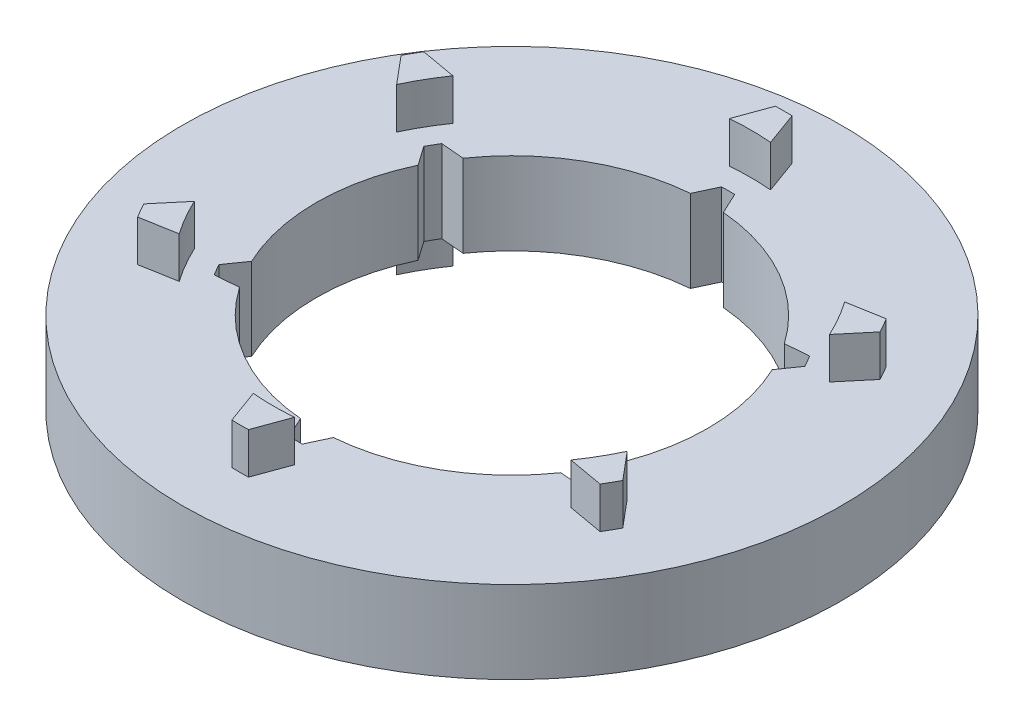
from build123d import *

# Parameters (mm, degrees)
SKETCH1_R           = 40
BOSS_EXTRUDE1_DEPTH = 10
BOSS_EXTRUDE6_DEPTH = 5
BOSS_EXTRUDE7_START = -15
BOSS_EXTRUDE7_DEPTH = 5


with BuildPart() as part:
    # Sketch1 → Boss-Extrude1 (new body)
    with BuildSketch(Plane(origin=(0, 0, 0), x_dir=(1, 0, 0), z_dir=(0, 1, 0))):
        with Locations(Location((0, 0, 0), (0, 0, 270))):
            Circle(SKETCH1_R)
        with BuildLine():
            Line((-2, 23.665639649), (-0.800587161, 26.237788783))
            ThreePointArc((-0.800587161, 26.237788783), (0, 26.25), (0.800587161, 26.237788783))
            Line((0.800587161, 26.237788783), (2, 23.665639649))
            ThreePointArc((2, 23.665639649), (11.875, 20.56810334), (19.495045133, 13.564870632))
            Line((19.495045133, 13.564870632), (22.322298044, 13.812223211))
            ThreePointArc((22.322298044, 13.812223211), (22.733166849, 13.125), (23.122885205, 12.425565572))
            Line((23.122885205, 12.425565572), (21.495045133, 10.100769017))
            ThreePointArc((21.495045133, 10.100769017), (23.75, 0), (21.495045133, -10.100769017))
            Line((21.495045133, -10.100769017), (23.122885205, -12.425565572))
            ThreePointArc((23.122885205, -12.425565572), (22.733166849, -13.125), (22.322298044, -13.812223211))
            Line((22.322298044, -13.812223211), (19.495045133, -13.564870632))
            ThreePointArc((19.495045133, -13.564870632), (11.875, -20.56810334), (2, -23.665639649))
            Line((2, -23.665639649), (0.800587161, -26.237788783))
            ThreePointArc((0.800587161, -26.237788783), (0, -26.25), (-0.800587161, -26.237788783))
            Line((-0.800587161, -26.237788783), (-2, -23.665639649))
            ThreePointArc((-2, -23.665639649), (-11.875, -20.56810334), (-19.495045133, -13.564870632))
            Line((-19.495045133, -13.564870632), (-22.322298044, -13.812223211))
            ThreePointArc((-22.322298044, -13.812223211), (-22.733166849, -13.125), (-23.122885205, -12.425565572))
            Line((-23.122885205, -12.425565572), (-21.495045133, -10.100769017))
            ThreePointArc((-21.495045133, -10.100769017), (-23.75, 0), (-21.495045133, 10.100769017))
            Line((-21.495045133, 10.100769017), (-23.122885205, 12.425565572))
            ThreePointArc((-23.122885205, 12.425565572), (-22.733166849, 13.125), (-22.322298044, 13.812223211))
            Line((-22.322298044, 13.812223211), (-19.495045133, 13.564870632))
            ThreePointArc((-19.495045133, 13.564870632), (-11.875, 20.56810334), (-2, 23.665639649))
        make_face(mode=Mode.SUBTRACT)
    extrude(amount=BOSS_EXTRUDE1_DEPTH)

    # 4,5,6 → Boss-Extrude6 (add)
    with BuildSketch(Plane(origin=(0, 10, 0), x_dir=(1, 0, 0), z_dir=(0, 1, 0))):
        with BuildLine():
            Line((2.5, 28.892040426), (1.010456949, 32.984526323))
            ThreePointArc((1.010456949, 32.984526323), (0, 33), (-1.010456949, 32.984526323))
            Line((-1.010456949, 32.984526323), (-2.5, 28.892040426))
            ThreePointArc((-2.5, 28.892040426), (0, 29), (2.5, 28.892040426))
        make_face()
        with BuildLine():
            Line((23.771240976, 16.611083723), (28.060209253, 17.367344549))
            ThreePointArc((28.060209253, 17.367344549), (28.578838325, 16.5), (29.070666202, 15.617181774))
            Line((29.070666202, 15.617181774), (26.271240976, 12.280956704))
            ThreePointArc((26.271240976, 12.280956704), (25.11473671, 14.5), (23.771240976, 16.611083723))
        make_face()
        with BuildLine():
            Line((26.271240976, -12.280956704), (29.070666202, -15.617181774))
            ThreePointArc((29.070666202, -15.617181774), (28.578838325, -16.5), (28.060209253, -17.367344549))
            Line((28.060209253, -17.367344549), (23.771240976, -16.611083723))
            ThreePointArc((23.771240976, -16.611083723), (25.11473671, -14.5), (26.271240976, -12.280956704))
        make_face()
        with BuildLine():
            Line((2.5, -28.892040426), (1.010456949, -32.984526323))
            ThreePointArc((1.010456949, -32.984526323), (0, -33), (-1.010456949, -32.984526323))
            Line((-1.010456949, -32.984526323), (-2.5, -28.892040426))
            ThreePointArc((-2.5, -28.892040426), (0, -29), (2.5, -28.892040426))
        make_face()
        with BuildLine():
            Line((-23.771240976, -16.611083723), (-28.060209253, -17.367344549))
            ThreePointArc((-28.060209253, -17.367344549), (-28.578838325, -16.5), (-29.070666202, -15.617181774))
            Line((-29.070666202, -15.617181774), (-26.271240976, -12.280956704))
            ThreePointArc((-26.271240976, -12.280956704), (-25.11473671, -14.5), (-23.771240976, -16.611083723))
        make_face()
        with BuildLine():
            Line((-26.271240976, 12.280956704), (-29.070666202, 15.617181774))
            ThreePointArc((-29.070666202, 15.617181774), (-28.578838325, 16.5), (-28.060209253, 17.367344549))
            Line((-28.060209253, 17.367344549), (-23.771240976, 16.611083723))
            ThreePointArc((-23.771240976, 16.611083723), (-25.11473671, 14.5), (-26.271240976, 12.280956704))
        make_face()
    extrude(amount=BOSS_EXTRUDE6_DEPTH)

    # 4,5,6<2> → Boss-Extrude7 (add)
    with BuildSketch(Plane(origin=(0, 10, 0), x_dir=(1, 0, 0), z_dir=(0, 1, 0)).offset(BOSS_EXTRUDE7_START)):
        with BuildLine():
            Line((2.5, 28.892040426), (1.010456949, 32.984526323))
            ThreePointArc((1.010456949, 32.984526323), (0, 33), (-1.010456949, 32.984526323))
            Line((-1.010456949, 32.984526323), (-2.5, 28.892040426))
            ThreePointArc((-2.5, 28.892040426), (0, 29), (2.5, 28.892040426))
        make_face()
        with BuildLine():
            Line((23.771240976, 16.611083723), (28.060209253, 17.367344549))
            ThreePointArc((28.060209253, 17.367344549), (28.578838325, 16.5), (29.070666202, 15.617181774))
            Line((29.070666202, 15.617181774), (26.271240976, 12.280956704))
            ThreePointArc((26.271240976, 12.280956704), (25.11473671, 14.5), (23.771240976, 16.611083723))
        make_face()
        with BuildLine():
            Line((26.271240976, -12.280956704), (29.070666202, -15.617181774))
            ThreePointArc((29.070666202, -15.617181774), (28.578838325, -16.5), (28.060209253, -17.367344549))
            Line((28.060209253, -17.367344549), (23.771240976, -16.611083723))
            ThreePointArc((23.771240976, -16.611083723), (25.11473671, -14.5), (26.271240976, -12.280956704))
        make_face()
        with BuildLine():
            Line((2.5, -28.892040426), (1.010456949, -32.984526323))
            ThreePointArc((1.010456949, -32.984526323), (0, -33), (-1.010456949, -32.984526323))
            Line((-1.010456949, -32.984526323), (-2.5, -28.892040426))
            ThreePointArc((-2.5, -28.892040426), (0, -29), (2.5, -28.892040426))
        make_face()
        with BuildLine():
            Line((-23.771240976, -16.611083723), (-28.060209253, -17.367344549))
            ThreePointArc((-28.060209253, -17.367344549), (-28.578838325, -16.5), (-29.070666202, -15.617181774))
            Line((-29.070666202, -15.617181774), (-26.271240976, -12.280956704))
            ThreePointArc((-26.271240976, -12.280956704), (-25.11473671, -14.5), (-23.771240976, -16.611083723))
        make_face()
        with BuildLine():
            Line((-26.271240976, 12.280956704), (-29.070666202, 15.617181774))
            ThreePointArc((-29.070666202, 15.617181774), (-28.578838325, 16.5), (-28.060209253, 17.367344549))
            Line((-28.060209253, 17.367344549), (-23.771240976, 16.611083723))
            ThreePointArc((-23.771240976, 16.611083723), (-25.11473671, 14.5), (-26.271240976, 12.280956704))
        make_face()
    extrude(amount=BOSS_EXTRUDE7_DEPTH)


solid = part.part
